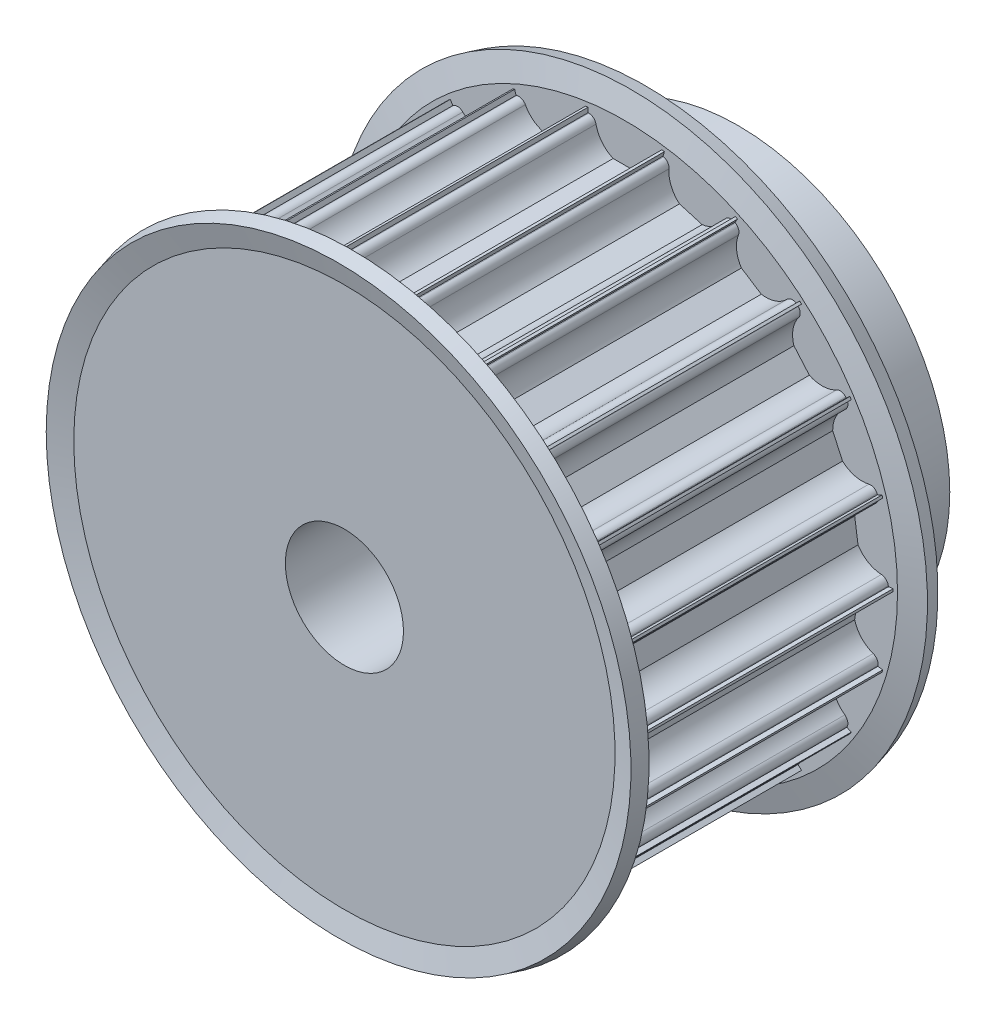
from build123d import *

# Parameters (mm, degrees)
CUT_EXTRUDE1_REACH = 57.544
CIRPATTERN1_COUNT  = 22


with BuildPart() as part:
    # Sketch1 → Revolve1 (revolve)
    with BuildSketch(Plane(origin=(0, 0, 0), x_dir=(0, 0, -1), z_dir=(1, 0, 0)), mode=Mode.PRIVATE) as revolve1_sk:
        Polygon((0, 6), (40, 6), (40, 21.5), (30, 21.5), (30, 27.25), (0, 27.25), align=None)
    revolve(revolve1_sk.sketch.rotate(Axis((0, 0, 0), (0, 0, -1)), 90), axis=Axis((0, 0, 0), (0, 0, -1)))

    # Sketch2 → Cut-Extrude1 (cut, up to next)
    with BuildSketch(Plane.XY, mode=Mode.PRIVATE) as cut_extrude1_sk1:
        with BuildLine():
            Line((-3.674234614, 26.5), (-3.75, 26.5))
            Line((-3.75, 26.5), (-3.75, 28.5))
            Line((-3.75, 28.5), (3.75, 28.5))
            Line((3.75, 28.5), (3.75, 26.5))
            Line((3.75, 26.5), (3.674234614, 26.5))
            ThreePointArc((3.674234614, 26.5), (3.199892965, 26.330947502), (2.939387691, 25.9))
            ThreePointArc((2.939387691, 25.9), (2.331759211, 24.612435701), (1.198957881, 23.75))
            Line((1.198957881, 23.75), (-1.198957881, 23.75))
            ThreePointArc((-1.198957881, 23.75), (-2.331759211, 24.612435701), (-2.939387691, 25.9))
            ThreePointArc((-2.939387691, 25.9), (-3.199892965, 26.330947502), (-3.674234614, 26.5))
        make_face()
    cut_extrude1_tool1 = extrude(cut_extrude1_sk1.sketch, amount=-CUT_EXTRUDE1_REACH, mode=Mode.PRIVATE) & part.part
    cut_extrude1 = cut_extrude1_tool1.solids().sort_by_distance((0, 26.435169, 0))[0]
    add(cut_extrude1, mode=Mode.SUBTRACT)

    # CirPattern1: Cut-Extrude1 ×22 about axis
    cirpattern1_axis = Axis((0, 0, 0), (0, 0, 1))
    for i in range(1, CIRPATTERN1_COUNT):
        add(cut_extrude1.rotate(cirpattern1_axis, i * 360 / CIRPATTERN1_COUNT), mode=Mode.SUBTRACT)

    # Sketch3 → Revolve2 (revolve)
    with BuildSketch(Plane(origin=(0, 0, 0), x_dir=(0, 0, -1), z_dir=(1, 0, 0)), mode=Mode.PRIVATE) as revolve2_sk:
        Polygon((30, 21.5), (30, 27.492521254), (30.591966801, 29.701771432), (29.143078062, 30.09), (28.5, 27.69), (28.5, 21.5), align=None)
        Polygon((0.856921938, 30.09), (1.5, 27.69), (1.5, 21.5), (0, 21.5), (0, 27.492521254), (-0.591966801, 29.701771432), align=None)
    revolve(revolve2_sk.sketch.rotate(Axis((0, 0, 0), (0, 0, 1)), 90), axis=Axis((0, 0, 0), (0, 0, 1)))


solid = part.part
